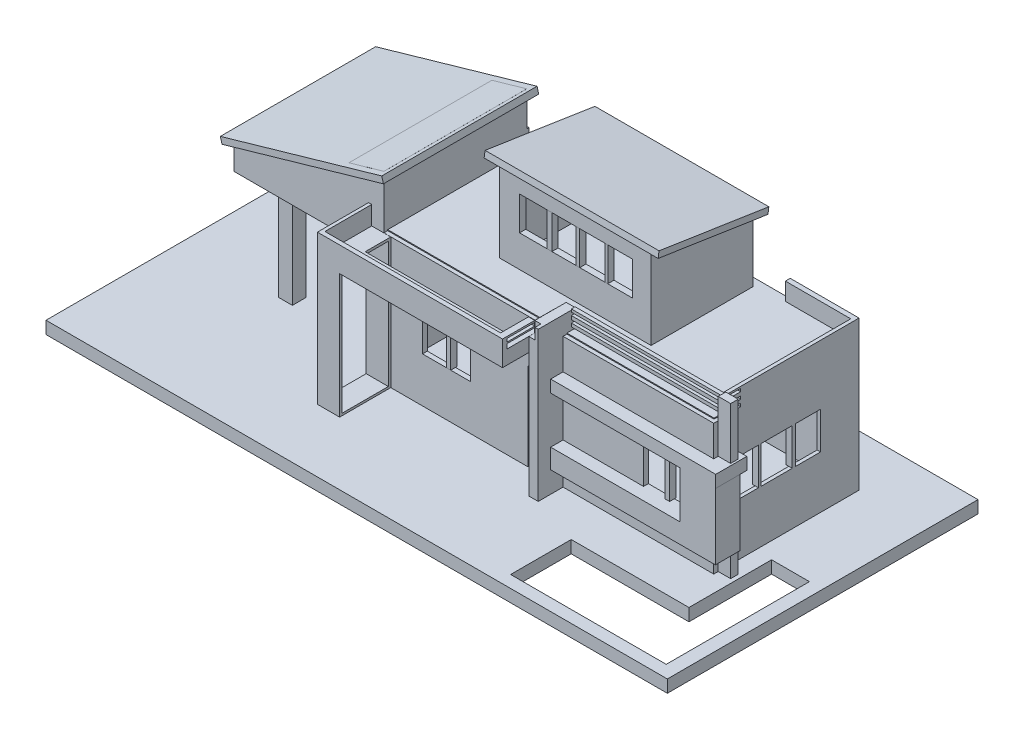
from build123d import *

# Parameters (mm, degrees)
SKETCH1_W                 = 254
SKETCH1_H                 = 127
BOSS_EXTRUDE1_DEPTH       = 5.08
CUT_EXTRUDE1_DEPTH        = 5.08
SKETCH3_W                 = 1.407328117
SKETCH3_H                 = 59.389246538
BOSS_EXTRUDE2_DEPTH       = 60.96
SKETCH4_W                 = 139.7
SKETCH4_H                 = 1.970259363
SKETCH4_H_2               = 1.970259364
BOSS_EXTRUDE3_DEPTH       = 60.96
SKETCH5_W                 = 19.984059262
SKETCH5_H                 = 19.139662391
SKETCH5_W_2               = 7.976511644
SKETCH5_H_2               = 35.821037455
SKETCH5_W_3               = 19.6975506
SKETCH5_H_3               = 15.51598842
SKETCH5_W_4               = 141.107328117
SKETCH5_H_4               = 7.570749969
CUT_EXTRUDE2_DEPTH        = 5.08
SKETCH6_W                 = 33.539814466
SKETCH6_H                 = 15.135872174
CUT_EXTRUDE3_DEPTH        = 7.62
SKETCH8_W                 = 3.096121857
SKETCH8_H                 = 61.997340432
BOSS_EXTRUDE4_DEPTH       = 5.08
SKETCH11_W                = 139.7
SKETCH11_H                = 2.54
EXTRUDE_THIN1_DEPTH       = 55.88
BOSS_EXTRUDE7_DEPTH       = 7.62
BOSS_EXTRUDE7_DEPTH_BACK  = 7.62
BOSS_EXTRUDE7_START       = 2.54
SKETCH13_W                = 3.81
SKETCH13_H                = 60.96
BOSS_EXTRUDE8_DEPTH       = 5.08
BOSS_EXTRUDE8_DEPTH_BACK  = 7.62
SKETCH14_W                = 67.472462437
SKETCH14_H                = 4.972746874
BOSS_EXTRUDE9_DEPTH       = 5.08
BOSS_EXTRUDE9_DEPTH_BACK  = 5.08
SKETCH15_W                = 14.478
SKETCH15_H                = 27.143979227
SKETCH17_W                = 52.863971043
SKETCH17_H                = 8.004316836
BOSS_EXTRUDE10_DEPTH      = 5.08
SKETCH19_W                = 61.589405368
SKETCH19_H                = 1.548060928
BOSS_EXTRUDE12_DEPTH      = 7.62
SKETCH20_W                = 61.589405368
SKETCH20_H                = 1.188994058
SKETCH20_H_2              = 1.191193579
SKETCH20_H_3              = 1.259956069
CUT_EXTRUDE4_DEPTH        = 7.62
SKETCH21_W                = 55.448727811
SKETCH21_H                = 51.231774644
BOSS_EXTRUDE13_DEPTH      = 2.54
BOSS_EXTRUDE15_DEPTH      = 58.42
SKETCH27_W                = 5.629312468
SKETCH27_H                = 5.629312468
SKETCH27_H_2              = 6.192243715
BOSS_EXTRUDE16_DEPTH      = 45.72
SKETCH29_W                = 106.68
SKETCH29_H                = 7.188225356
CUT_EXTRUDE5_DEPTH        = 2.54
SKETCH30_W                = 61.936055928
SKETCH30_H                = 41.670531043
SKETCH30_W_2              = 56.856055928
SKETCH30_H_2              = 36.590531043
EXTRUDE_THIN3_DEPTH       = 40.64
CUT_EXTRUDE6_DEPTH        = 63.5
EXTRUDE_THIN4_DEPTH       = 5.08
EXTRUDE_THIN4_DEPTH_BACK  = 66.04
SKETCH34_W                = 46.160362239
SKETCH34_H                = 13.791815547
CUT_EXTRUDE7_DEPTH        = 17.78
SKETCH35_W                = 1.970259364
SKETCH35_H                = 13.791815547
BOSS_EXTRUDE17_DEPTH      = 2.54
SKETCH35_W_2              = 1.526410404
BOSS_EXTRUDE17_2_DEPTH    = 2.54
SKETCH35_W_3              = 1.181441054
BOSS_EXTRUDE17_3_DEPTH    = 2.54
SKETCH39_W                = 1.686272221
SKETCH39_H                = 15.51598842
BOSS_EXTRUDE18_DEPTH      = 2.54
SKETCH42_W                = 1.970259364
SKETCH42_H                = 19.139662391
BOSS_EXTRUDE19_DEPTH      = 2.54
SKETCH43_W                = 1.125862494
SKETCH43_H                = 15.135872174
SKETCH43_W_2              = 1.266595305
BOSS_EXTRUDE20_DEPTH      = 2.54
SKETCH47_W                = 9.073666152
SKETCH47_H                = 20.904442298
BOSS_EXTRUDE21_DEPTH      = 53.34
SKETCH48_W                = 19.019146822
SKETCH48_H                = 51.429779471
CUT_EXTRUDE9_DEPTH        = 10.16
EXTRUDE_THIN6_DEPTH       = 2.54
EXTRUDE_THIN6_DEPTH_BACK  = 60.96
SKETCH53_W                = 75.66793383
SKETCH53_H                = 10.452221149
BOSS_EXTRUDE22_DEPTH      = 2.54
BOSS_EXTRUDE23_DEPTH      = 7.62
BOSS_EXTRUDE23_DEPTH_BACK = 2.54
SKETCH54_W                = 2.558745771
SKETCH54_H                = 20.904442298
SKETCH55_W                = 19.543174897
SKETCH55_H                = 4.456518569
CUT_EXTRUDE10_DEPTH       = 2.54
SKETCH58_W                = 11.805186879
SKETCH58_H                = 4.456518569
CUT_EXTRUDE12_DEPTH       = 2.54
SKETCH61_W                = 75.66793383
SKETCH61_H                = 1.763331908
BOSS_EXTRUDE25_DEPTH      = 7.62
SKETCH63_W                = 1.2904173
SKETCH63_H                = 19.14111039
BOSS_EXTRUDE26_DEPTH      = 7.62
SKETCH64_W                = 11.403122372
SKETCH64_H                = 0.570290843
SKETCH64_H_2              = 0.707472678
BOSS_EXTRUDE27_DEPTH      = 2.54


with BuildPart() as part:
    # Sketch1 → Boss-Extrude1 (new body)
    with BuildSketch(Plane(origin=(0, 0, 0), x_dir=(1, 0, 0), z_dir=(0, 1, 0))):
        Rectangle(SKETCH1_W, SKETCH1_H)
    extrude(amount=BOSS_EXTRUDE1_DEPTH)

    # Sketch2 → Cut-Extrude1 (cut)
    with BuildSketch(Plane(origin=(0, 5.08, 0), x_dir=(1, 0, 0), z_dir=(0, 1, 0))):
        Polygon((121.593149311, 0), (121.593149311, -58.544849668), (57.981918422, -58.544849668), (57.981918422, -33.775874809), (106.112540024, -33.775874809), (106.112540024, 0), align=None)
    extrude(amount=-CUT_EXTRUDE1_DEPTH, mode=Mode.SUBTRACT)

    # Sketch3 → Boss-Extrude2 (add)
    with BuildSketch(Plane(origin=(0, 5.08, 0), x_dir=(1, 0, 0), z_dir=(0, 1, 0))):
        with Locations((98.653701004, 12.806685865)):
            Rectangle(SKETCH3_W, SKETCH3_H)
    extrude(amount=BOSS_EXTRUDE2_DEPTH)

    # Sketch4 → Boss-Extrude3 (add)
    with BuildSketch(Plane(origin=(0, 5.08, 0), x_dir=(1, 0, 0), z_dir=(0, 1, 0))):
        with Locations((28.100036945, -15.902807723)):
            Rectangle(SKETCH4_W, SKETCH4_H)
        with Locations((28.100036945, 41.516179452)):
            Rectangle(SKETCH4_W, SKETCH4_H_2)
    extrude(amount=BOSS_EXTRUDE3_DEPTH)

    # Sketch5 → Cut-Extrude2 (cut)
    with BuildSketch(Plane.XY.offset(16.887937404)):
        with Locations((80.639901106, 31.33120626)):
            Rectangle(SKETCH5_W, SKETCH5_H)
        with Locations((27.370969182, 22.990518727)):
            Rectangle(SKETCH5_W_2, SKETCH5_H_2)
        with Locations((-9.8487753, 31.264313342)):
            Rectangle(SKETCH5_W_3, SKETCH5_H_3)
        with Locations((28.803701003, 62.254625016)):
            Rectangle(SKETCH5_W_4, SKETCH5_H_4)
    extrude(amount=-CUT_EXTRUDE2_DEPTH, mode=Mode.SUBTRACT)

    # Sketch6 → Cut-Extrude3 (cut)
    with BuildSketch(Plane(origin=(99.357365062, 0, 0), x_dir=(0, 0, -1), z_dir=(1, 0, 0))):
        with Locations((9.999025685, 34.05183674)):
            Rectangle(SKETCH6_W, SKETCH6_H)
    extrude(amount=-CUT_EXTRUDE3_DEPTH, mode=Mode.SUBTRACT)

    # Sketch8 → Boss-Extrude4 (add)
    with BuildSketch(Plane(origin=(99.357365062, 0, 0), x_dir=(0, 0, -1), z_dir=(1, 0, 0))):
        with Locations((-13.510349924, 36.078670216)):
            Rectangle(SKETCH8_W, SKETCH8_H)
    extrude(amount=BOSS_EXTRUDE4_DEPTH)

    # Sketch11 → Extrude-Thin1 (add)
    with BuildSketch(Plane.XY.offset(-40.53104977)):
        with Locations((28.100036945, 57.581774644)):
            Rectangle(SKETCH11_W, SKETCH11_H)
    extrude(amount=EXTRUDE_THIN1_DEPTH)

    # Sketch13 → Boss-Extrude7 (add, two sides: drawn at the far end of the back side and taken through both)
    with BuildSketch(Plane.XY.offset(16.887937404).offset(BOSS_EXTRUDE7_START - BOSS_EXTRUDE7_DEPTH_BACK)):
        with Locations((35.862959694, 35.56)):
            Rectangle(SKETCH13_W, SKETCH13_H)
    extrude(amount=BOSS_EXTRUDE7_DEPTH + BOSS_EXTRUDE7_DEPTH_BACK)

    # Sketch14 → Boss-Extrude8 (add, two sides: drawn at the far end of the back side and taken through both)
    with BuildSketch(Plane.XY.offset(16.887937404).offset(-BOSS_EXTRUDE8_DEPTH_BACK)):
        with Locations((71.504190913, 43.387410892)):
            Rectangle(SKETCH14_W, SKETCH14_H)
    extrude(amount=BOSS_EXTRUDE8_DEPTH + BOSS_EXTRUDE8_DEPTH_BACK)

    # Sketch15 → Boss-Extrude9 (add, two sides: drawn at the far end of the back side and taken through both)
    with BuildSketch(Plane.XY.offset(16.887937404).offset(-BOSS_EXTRUDE9_DEPTH_BACK)):
        with Locations((97.870930737, 27.329047841)):
            Rectangle(SKETCH15_W, SKETCH15_H)
    extrude(amount=BOSS_EXTRUDE9_DEPTH + BOSS_EXTRUDE9_DEPTH_BACK)

    # Sketch17 → Boss-Extrude10 (add)
    with BuildSketch(Plane.XY.offset(16.887937404)):
        with Locations((64.199945216, 17.759216646)):
            Rectangle(SKETCH17_W, SKETCH17_H)
    extrude(amount=BOSS_EXTRUDE10_DEPTH)

    # Sketch19 → Boss-Extrude12 (add)
    with BuildSketch(Plane(origin=(0, 58.851774644, 0), x_dir=(1, 0, 0), z_dir=(0, 1, 0))):
        with Locations((68.562662378, -12.736319459)):
            Rectangle(SKETCH19_W, SKETCH19_H)
    extrude(amount=BOSS_EXTRUDE12_DEPTH)

    # Sketch20 → Cut-Extrude4 (cut)
    with BuildSketch(Plane.XY.offset(13.510349923)):
        with Locations((68.562662378, 64.740314725)):
            Rectangle(SKETCH20_W, SKETCH20_H)
        with Locations((68.562662378, 62.066177855)):
            Rectangle(SKETCH20_W, SKETCH20_H_2)
        with Locations((68.562662378, 59.481752679)):
            Rectangle(SKETCH20_W, SKETCH20_H_3)
    extrude(amount=-CUT_EXTRUDE4_DEPTH, mode=Mode.SUBTRACT)

    # Sketch21 → Boss-Extrude13 (add)
    with BuildSketch(Plane.ZY.offset(41.749963055)):
        with Locations((-12.806685865, 30.695887322)):
            Rectangle(SKETCH21_W, SKETCH21_H)
    extrude(amount=-BOSS_EXTRUDE13_DEPTH)

    # Sketch25 → Boss-Extrude15 (add)
    with BuildSketch(Plane.XY.offset(16.887937404)):
        Polygon((-35.464668549, 80.261963701), (-35.464668549, 49.58221075), (-96.824174452, 49.58221075), (-96.824174452, 62.529629427), align=None)
    extrude(amount=-BOSS_EXTRUDE15_DEPTH)

    # Sketch27 → Boss-Extrude16 (add)
    with BuildSketch(Plane(origin=(0, 5.08, 0), x_dir=(1, 0, 0), z_dir=(0, 1, 0))):
        with Locations((-84.721152645, -5.066381221)):
            Rectangle(SKETCH27_W, SKETCH27_H)
        with Locations((-84.721152645, 28.990959211)):
            Rectangle(SKETCH27_W, SKETCH27_H_2)
    extrude(amount=BOSS_EXTRUDE16_DEPTH)

    # Sketch29 → Cut-Extrude5 (cut)
    with BuildSketch(Plane.XY.offset(-40.53104977)):
        with Locations((17.875331451, 62.445887322)):
            Rectangle(SKETCH29_W, SKETCH29_H)
    extrude(amount=-CUT_EXTRUDE5_DEPTH, mode=Mode.SUBTRACT)

    # Sketch30 → Extrude-Thin3 (add)
    with BuildSketch(Plane(origin=(0, 58.851774644, 0), x_dir=(1, 0, 0), z_dir=(0, 1, 0))):
        with Locations((28.428027964, 18.295265522)):
            Rectangle(SKETCH30_W, SKETCH30_H)
        with Locations((28.428027964, 18.295265522)):
            Rectangle(SKETCH30_W_2, SKETCH30_H_2, mode=Mode.SUBTRACT)
    extrude(amount=EXTRUDE_THIN3_DEPTH)

    # Sketch31 → Cut-Extrude6 (cut)
    with BuildSketch(Plane(origin=(59.396055928, 0, 0), x_dir=(0, 0, -1), z_dir=(1, 0, 0))):
        Polygon((-2.54, 95.402381346), (39.130531043, 88.981936873), (39.130531043, 99.491774644), (-2.54, 99.491774644), align=None)
    extrude(amount=-CUT_EXTRUDE6_DEPTH, mode=Mode.SUBTRACT)

    # Sketch33 → Extrude-Thin4 (add, two sides: drawn at the far end of the back side and taken through both)
    with BuildSketch(Plane(origin=(59.396055928, 0, 0), x_dir=(0, 0, -1), z_dir=(1, 0, 0)).offset(-EXTRUDE_THIN4_DEPTH_BACK)):
        Polygon((-4.362717163, 95.831812275), (40.53104977, 88.981936873), (40.147931396, 86.470996748), (-4.745835537, 93.32087215), align=None)
    extrude(amount=EXTRUDE_THIN4_DEPTH + EXTRUDE_THIN4_DEPTH_BACK)

    # Sketch34 → Cut-Extrude7 (cut)
    with BuildSketch(Plane.XY.offset(2.54)):
        with Locations((28.709493588, 78.736391901)):
            Rectangle(SKETCH34_W, SKETCH34_H)
    extrude(amount=-CUT_EXTRUDE7_DEPTH, mode=Mode.SUBTRACT)

    # Sketch42 → Boss-Extrude19 (add)
    with BuildSketch(Plane.XY.offset(16.887937404)):
        with Locations((80.358435482, 31.33120626)):
            Rectangle(SKETCH42_W, SKETCH42_H)
    extrude(amount=-BOSS_EXTRUDE19_DEPTH)

    # Sketch43 → Boss-Extrude20 (add)
    with BuildSketch(Plane(origin=(99.357365062, 0, 0), x_dir=(0, 0, -1), z_dir=(1, 0, 0))):
        with Locations((1.970259364, 34.05183674)):
            Rectangle(SKETCH43_W, SKETCH43_H)
        with Locations((15.832441317, 34.05183674)):
            Rectangle(SKETCH43_W_2, SKETCH43_H)
    extrude(amount=-BOSS_EXTRUDE20_DEPTH)

    # Sketch47 → Boss-Extrude21 (add)
    with BuildSketch(Plane(origin=(0, 5.08, 0), x_dir=(1, 0, 0), z_dir=(0, 1, 0))):
        with Locations((-37.213129979, -27.340158553)):
            Rectangle(SKETCH47_W, SKETCH47_H)
    extrude(amount=BOSS_EXTRUDE21_DEPTH)

    # Sketch48 → Cut-Extrude9 (cut)
    with BuildSketch(Plane(origin=(-32.676296903, 0, 0), x_dir=(0, 0, -1), z_dir=(1, 0, 0))):
        with Locations((-27.372112453, 31.676861853)):
            Rectangle(SKETCH48_W, SKETCH48_H)
    extrude(amount=-CUT_EXTRUDE9_DEPTH, mode=Mode.SUBTRACT)

    # Sketch51 → Extrude-Thin6 (add, two sides: drawn at the far end of the back side and taken through both)
    with BuildSketch(Plane.XY.offset(16.887937404).offset(-EXTRUDE_THIN6_DEPTH_BACK)):
        Polygon((-99.818901936, 61.723526262), (-33.831512312, 80.715018885), (-33.129004113, 78.274100568), (-99.116393737, 59.282607945), align=None)
    extrude(amount=EXTRUDE_THIN6_DEPTH + EXTRUDE_THIN6_DEPTH_BACK)

    # Sketch53 → Boss-Extrude22 (add)
    with BuildSketch(Plane(origin=(0, 58.42, 0), x_dir=(1, 0, 0), z_dir=(0, 1, 0))):
        with Locations((-3.91599614, -32.566269128)):
            Rectangle(SKETCH53_W, SKETCH53_H)
    extrude(amount=-BOSS_EXTRUDE22_DEPTH)

    # Sketch54 → Boss-Extrude23 (add, two sides: drawn at the far end of the back side and taken through both)
    with BuildSketch(Plane(origin=(0, 58.42, 0), x_dir=(1, 0, 0), z_dir=(0, 1, 0)).offset(-BOSS_EXTRUDE23_DEPTH_BACK)):
        with Locations((32.63859789, -27.340158553)):
            Rectangle(SKETCH54_W, SKETCH54_H)
    extrude(amount=BOSS_EXTRUDE23_DEPTH + BOSS_EXTRUDE23_DEPTH_BACK)

    # Sketch55 → Cut-Extrude10 (cut)
    with BuildSketch(Plane.ZY.offset(-31.359225004)):
        with Locations((26.659524852, 63.811740716)):
            Rectangle(SKETCH55_W, SKETCH55_H)
    extrude(amount=-CUT_EXTRUDE10_DEPTH, mode=Mode.SUBTRACT)

    # Sketch58 → Cut-Extrude12 (cut)
    with BuildSketch(Plane.ZY.offset(-33.899225004)):
        with Locations((30.528518862, 63.811740716)):
            Rectangle(SKETCH58_W, SKETCH58_H)
    extrude(amount=-CUT_EXTRUDE12_DEPTH, mode=Mode.SUBTRACT)

    # Sketch61 → Boss-Extrude25 (add)
    with BuildSketch(Plane(origin=(0, 58.42, 0), x_dir=(1, 0, 0), z_dir=(0, 1, 0))):
        with Locations((-3.91599614, -36.910713748)):
            Rectangle(SKETCH61_W, SKETCH61_H)
    extrude(amount=BOSS_EXTRUDE25_DEPTH)

    # Sketch63 → Boss-Extrude26 (add)
    with BuildSketch(Plane(origin=(0, 58.42, 0), x_dir=(1, 0, 0), z_dir=(0, 1, 0))):
        with Locations((-41.104754405, -26.458492599)):
            Rectangle(SKETCH63_W, SKETCH63_H)
    extrude(amount=BOSS_EXTRUDE26_DEPTH)

    # Sketch64 → Boss-Extrude27 (add)
    with BuildSketch(Plane(origin=(33.917970775, 0, 0), x_dir=(0, 0, -1), z_dir=(1, 0, 0))):
        with Locations((-30.327486608, 63.752263514)):
            Rectangle(SKETCH64_W, SKETCH64_H)
        with Locations((-30.327486608, 65.686263661)):
            Rectangle(SKETCH64_W, SKETCH64_H_2)
    extrude(amount=-BOSS_EXTRUDE27_DEPTH)


with BuildPart() as body_2:
    # Sketch35 → Boss-Extrude17 (new body)
    with BuildSketch(Plane.XY.offset(2.54)):
        with Locations((17.873067086, 78.736391901)):
            Rectangle(SKETCH35_W, SKETCH35_H)
    extrude(amount=-BOSS_EXTRUDE17_DEPTH)


with BuildPart() as body_3:
    # Sketch35 → Boss-Extrude17 2 (new body)
    with BuildSketch(Plane.XY.offset(2.54)):
        with Locations((29.472698789, 78.736391901)):
            Rectangle(SKETCH35_W_2, SKETCH35_H)
    extrude(amount=-BOSS_EXTRUDE17_2_DEPTH)


with BuildPart() as body_4:
    # Sketch35 → Boss-Extrude17 3 (new body)
    with BuildSketch(Plane.XY.offset(2.54)):
        with Locations((41.100024988, 78.736391901)):
            Rectangle(SKETCH35_W_3, SKETCH35_H)
    extrude(amount=-BOSS_EXTRUDE17_3_DEPTH)


with BuildPart() as body_5:
    # Sketch39 → Boss-Extrude18 (new body)
    with BuildSketch(Plane.XY.offset(16.887937404)):
        with Locations((-9.00563919, 31.264313342)):
            Rectangle(SKETCH39_W, SKETCH39_H)
    extrude(amount=-BOSS_EXTRUDE18_DEPTH)


solid = Compound([part.part, body_2.part, body_3.part, body_4.part, body_5.part])
